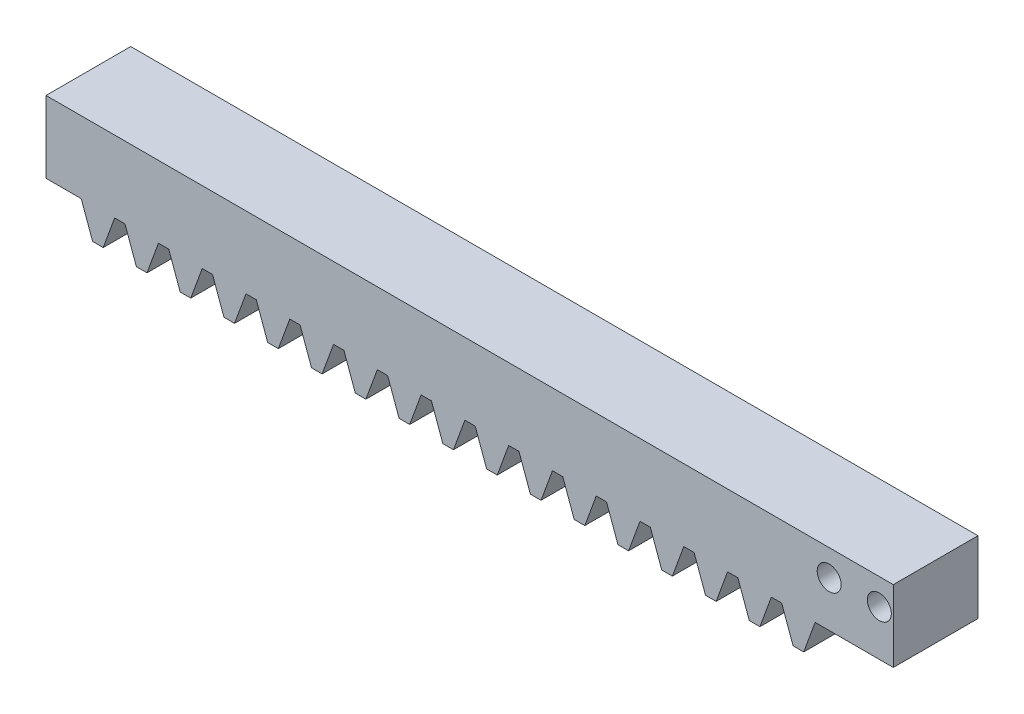
from build123d import *

# Parameters (mm, degrees)
F_17_START                                     = 42.4
F_17_RACK_TEETH_MODULE_2_5_AND_20_DEGREE_DEPTH = 15.2
TWO_START                                      = 42.4
SKETCH2_R                                      = 2.15
TWO_CROSSHEAD_JOINT_THROUGH_HOLES_DEPTH        = 15.2


with BuildPart() as part:
    # Sketch1 → 17 rack teeth - module 2.5 and 20 degrees (new body)
    with BuildSketch(Plane.XY.offset(F_17_START)):
        Polygon((-80, 43.5), (-80, 30.625), (-73.686737096, 30.625), (-71.639404529, 25), (-69.732264883, 25), (-67.684932315, 30.625), (-65.832755462, 30.625), (-63.785422895, 25), (-61.878283249, 25), (-59.830950681, 30.625), (-57.978773828, 30.625), (-55.931441261, 25), (-54.024301615, 25), (-51.976969047, 30.625), (-50.124792194, 30.625), (-48.077459627, 25), (-46.170319981, 25), (-44.122987413, 30.625), (-42.27081056, 30.625), (-40.223477993, 25), (-38.316338347, 25), (-36.269005779, 30.625), (-34.416828926, 30.625), (-32.369496359, 25), (-30.462356713, 25), (-28.415024145, 30.625), (-26.562847292, 30.625), (-24.515514725, 25), (-22.608375079, 25), (-20.561042511, 30.625), (-18.708865659, 30.625), (-16.661533091, 25), (-14.754393445, 25), (-12.707060877, 30.625), (-10.854884025, 30.625), (-8.807551457, 25), (-6.900411811, 25), (-4.853079243, 30.625), (-3.000902391, 30.625), (-0.953569823, 25), (0.953569823, 25), (3.000902391, 30.625), (4.853079243, 30.625), (6.900411811, 25), (8.807551457, 25), (10.854884025, 30.625), (12.707060877, 30.625), (14.754393445, 25), (16.661533091, 25), (18.708865659, 30.625), (20.561042511, 30.625), (22.608375079, 25), (24.515514725, 25), (26.562847292, 30.625), (28.415024145, 30.625), (30.462356713, 25), (32.369496359, 25), (34.416828926, 30.625), (36.269005779, 30.625), (38.316338347, 25), (40.223477993, 25), (42.27081056, 30.625), (44.122987413, 30.625), (46.170319981, 25), (48.077459627, 25), (50.124792194, 30.625), (51.976969047, 30.625), (54.024301615, 25), (55.931441261, 25), (57.978773828, 30.625), (72, 30.625), (72, 43.5), align=None)
    extrude(amount=F_17_RACK_TEETH_MODULE_2_5_AND_20_DEGREE_DEPTH)

    # Sketch2 → Two crosshead joint through holes (cut)
    with BuildSketch(Plane.XY.offset(TWO_START)):
        with Locations(Location((60.5, 38.8, 0), (0, 0, 180))):
            Circle(SKETCH2_R)
        with Locations(Location((69.5, 38.8, 0), (0, 0, 180))):
            Circle(SKETCH2_R)
    extrude(amount=TWO_CROSSHEAD_JOINT_THROUGH_HOLES_DEPTH, mode=Mode.SUBTRACT)


solid = part.part
